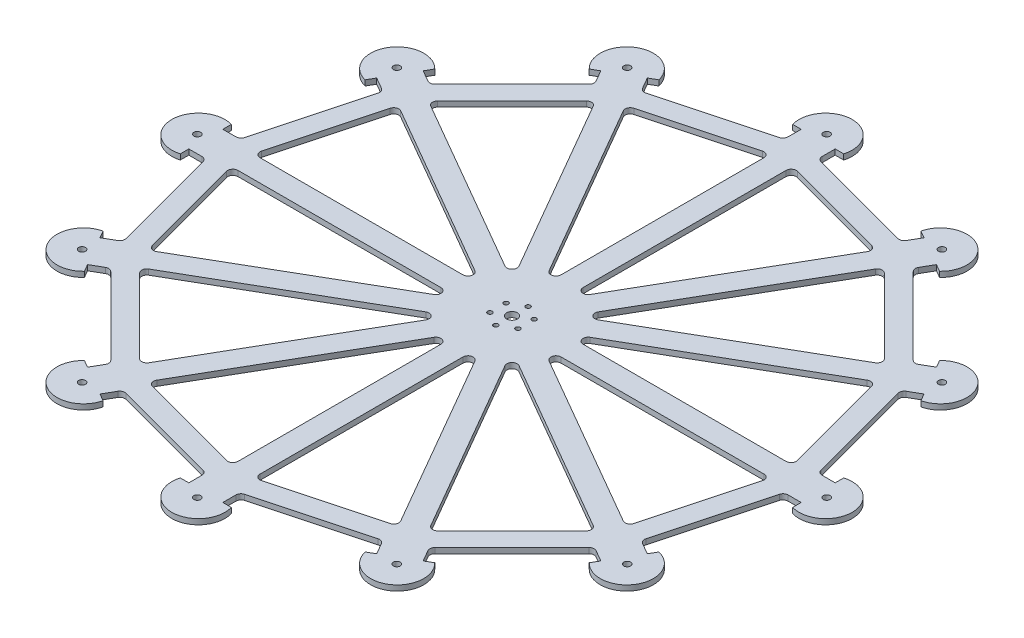
from build123d import *

# Parameters (mm, degrees)
BOSS_EXTRUDE1_DEPTH = 3.18
FILLET1_R           = 3
CIRPATTERN27_COUNT  = 12
SKETCH3_R           = 3.175
CUT_EXTRUDE1_DEPTH  = 283.860588276
SKETCH4_R           = 1.35
CUT_EXTRUDE2_DEPTH  = 283.860588276
SKETCH5_R           = 2
CUT_EXTRUDE3_DEPTH  = 283.860588276
CIRPATTERN28_COUNT  = 12


with BuildPart() as part:
    # Sketch1 → Boss-Extrude1 (new body)
    with BuildSketch(Plane(origin=(0, 0, 0), x_dir=(1, 0, 0), z_dir=(0, 1, 0))):
        with BuildLine():
            Line((0, 0), (0, 200))
            ThreePointArc((0, 200), (12.5, 193.75), (15, 180))
            Line((15, 180), (10, 180))
            Line((10, 180), (10, 170))
            Line((10, 170), (43.169872981, 161.112159322))
            Line((43.169872981, 161.112159322), (40.06404444, 149.521049406))
            Line((40.06404444, 149.521049406), (6.470476128, 158.522418906))
            Line((6.470476128, 158.522418906), (6.470476128, 24.148145657))
            Line((6.470476128, 24.148145657), (0, 0))
        make_face()
    boss_extrude1 = extrude(amount=BOSS_EXTRUDE1_DEPTH)

    # Mirror1: Boss-Extrude1 across plane
    add(boss_extrude1.mirror(Plane(origin=(43.169872981, 3.18, -161.112159322), x_dir=(-0.25881904510252035, 0, 0.9659258262890683), z_dir=(-0.9659258262890684, 0, -0.25881904510252035))))

    # Fillet1
    fillet1_edges = [part.edges().sort_by_distance(p)[0] for p in [
        (6.470476128, 1.59, -24.148145657),
        (73.657612752, 1.59, -140.519679906),
        (6.470476128, 1.59, -158.522418906),
        (76.339745962, 1.59, -152.224318643),
        (10, 1.59, -170),
    ]]
    fillet(fillet1_edges, radius=FILLET1_R)


with BuildPart() as cirpattern27_1:
    # CirPattern27: pattern copy
    add(part.part.rotate(Axis((0, 3.18, 0), (0, -1, 0)), 1 * 360 / CIRPATTERN27_COUNT))


with BuildPart() as cirpattern27_2:
    # CirPattern27: pattern copy
    add(part.part.rotate(Axis((0, 3.18, 0), (0, -1, 0)), 2 * 360 / CIRPATTERN27_COUNT))


with BuildPart() as cirpattern27_3:
    # CirPattern27: pattern copy
    add(part.part.rotate(Axis((0, 3.18, 0), (0, -1, 0)), 3 * 360 / CIRPATTERN27_COUNT))


with BuildPart() as cirpattern27_4:
    # CirPattern27: pattern copy
    add(part.part.rotate(Axis((0, 3.18, 0), (0, -1, 0)), 4 * 360 / CIRPATTERN27_COUNT))


with BuildPart() as cirpattern27_5:
    # CirPattern27: pattern copy
    add(part.part.rotate(Axis((0, 3.18, 0), (0, -1, 0)), 5 * 360 / CIRPATTERN27_COUNT))


with BuildPart() as cirpattern27_6:
    # CirPattern27: pattern copy
    add(part.part.rotate(Axis((0, 3.18, 0), (0, -1, 0)), 6 * 360 / CIRPATTERN27_COUNT))


with BuildPart() as cirpattern27_7:
    # CirPattern27: pattern copy
    add(part.part.rotate(Axis((0, 3.18, 0), (0, -1, 0)), 7 * 360 / CIRPATTERN27_COUNT))


with BuildPart() as cirpattern27_8:
    # CirPattern27: pattern copy
    add(part.part.rotate(Axis((0, 3.18, 0), (0, -1, 0)), 8 * 360 / CIRPATTERN27_COUNT))


with BuildPart() as cirpattern27_9:
    # CirPattern27: pattern copy
    add(part.part.rotate(Axis((0, 3.18, 0), (0, -1, 0)), 9 * 360 / CIRPATTERN27_COUNT))


with BuildPart() as cirpattern27_10:
    # CirPattern27: pattern copy
    add(part.part.rotate(Axis((0, 3.18, 0), (0, -1, 0)), 10 * 360 / CIRPATTERN27_COUNT))


with BuildPart() as cirpattern27_11:
    # CirPattern27: pattern copy
    add(part.part.rotate(Axis((0, 3.18, 0), (0, -1, 0)), 11 * 360 / CIRPATTERN27_COUNT))


with BuildPart() as cirpattern27_8_1:
    add(cirpattern27_8.part)

    # Combine1: union CirPattern27_9, CirPattern27_10, CirPattern27_11, part, CirPattern27_1, CirPattern27_2, CirPattern27_3, CirPattern27_4, CirPattern27_5, CirPattern27_6, CirPattern27_7
    add(cirpattern27_9.part)
    add(cirpattern27_10.part)
    add(cirpattern27_11.part)
    add(part.part)
    add(cirpattern27_1.part)
    add(cirpattern27_2.part)
    add(cirpattern27_3.part)
    add(cirpattern27_4.part)
    add(cirpattern27_5.part)
    add(cirpattern27_6.part)
    add(cirpattern27_7.part)

    # Sketch3 → Cut-Extrude1 (cut, through all)
    with BuildSketch(Plane(origin=(0, 3.18, 0), x_dir=(1, 0, 0), z_dir=(0, 1, 0))):
        Circle(SKETCH3_R)
    extrude(amount=-CUT_EXTRUDE1_DEPTH, mode=Mode.SUBTRACT)

    # Sketch4 → Cut-Extrude2 (cut, through all)
    with BuildSketch(Plane(origin=(0, 3.18, 0), x_dir=(1, 0, 0), z_dir=(0, 1, 0))):
        with Locations((0, 9.5)):
            Circle(SKETCH4_R)
        with Locations((8.227241336, 4.75)):
            Circle(SKETCH4_R)
        with Locations((8.227241336, -4.75)):
            Circle(SKETCH4_R)
        with Locations((0, -9.5)):
            Circle(SKETCH4_R)
        with Locations((-8.227241336, -4.75)):
            Circle(SKETCH4_R)
        with Locations((-8.227241336, 4.75)):
            Circle(SKETCH4_R)
    extrude(amount=-CUT_EXTRUDE2_DEPTH, mode=Mode.SUBTRACT)

    # Sketch5 → Cut-Extrude3 (cut, through all)
    with BuildSketch(Plane(origin=(0, 3.18, 0), x_dir=(1, 0, 0), z_dir=(0, 1, 0))):
        with Locations((0, 185)):
            Circle(SKETCH5_R)
    cut_extrude3 = extrude(amount=-CUT_EXTRUDE3_DEPTH, mode=Mode.SUBTRACT)

    # CirPattern28: Cut-Extrude3 ×12 about axis
    cirpattern28_axis = Axis((0, 3.18, 0), (0, -1, 0))
    for i in range(1, CIRPATTERN28_COUNT):
        add(cut_extrude3.rotate(cirpattern28_axis, i * 360 / CIRPATTERN28_COUNT), mode=Mode.SUBTRACT)


solid = cirpattern27_8_1.part
